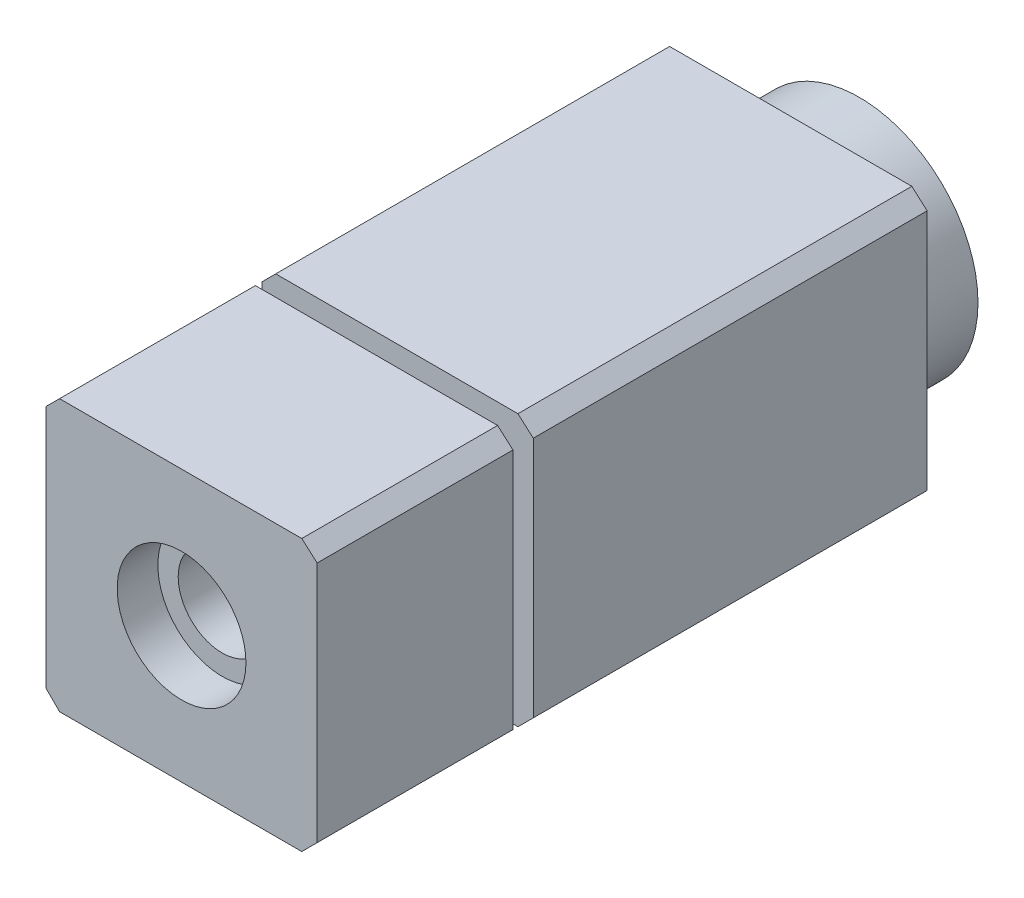
from build123d import *

# Parameters (mm, degrees)
EXTRUDE_1_DEPTH     = 80
SKETCH_3_R          = 17.5
EXTRUDE_2_DEPTH     = 10
EXTRUDE_START       = 10
SKETCH_4_R          = 17.5
EXTRUDE_3_DEPTH     = 10
SKETCH_6_R          = 9.5
CUT_EXTRUDE_3_DEPTH = 6
CUT_EXTRUDE_START   = -6
SKETCH_7_R          = 9.5
CUT_EXTRUDE_4_DEPTH = 6
SKETCH_8_R          = 6.5
CUT_EXTRUDE_5_DEPTH = 100
SKETCH_11_R         = 14.5
CUT_EXTRUDE_8_DEPTH = 3
SKETCH_13_R         = 17.5
EXTRUDE_5_DEPTH     = 10


with BuildPart() as part:
    # 草图1 → 凸台-拉伸1 (new body)
    with BuildSketch(Plane.XY):
        Polygon((-20, 18), (-18, 20), (17.735809733, 20), (20, 18), (20, -17.735809733), (17.735809733, -20), (-18, -20), (-20, -18), align=None)
    extrude(amount=EXTRUDE_1_DEPTH)

    # 草图3 → 凸台-拉伸2 (add)
    with BuildSketch(Plane.XY.offset(80)):
        Circle(SKETCH_3_R)
    extrude(amount=EXTRUDE_2_DEPTH)

    # 草图4 → 凸台-拉伸3 (add)
    with BuildSketch(Plane(origin=(0, 0, 0), x_dir=(-1, 0, 0), z_dir=(0, 0, -1)).offset(EXTRUDE_START)):
        with Locations(Location((0, 0, 0), (0, 0, 180))):
            Circle(SKETCH_4_R)
    extrude(amount=-EXTRUDE_3_DEPTH)

    # 草图6 → 切除-拉伸3 (cut)
    with BuildSketch(Plane(origin=(0, 0, -10), x_dir=(-1, 0, 0), z_dir=(0, 0, -1))):
        Circle(SKETCH_6_R)
    extrude(amount=-CUT_EXTRUDE_3_DEPTH, mode=Mode.SUBTRACT)

    # 草图7 → 切除-拉伸4 (cut)
    with BuildSketch(Plane.XY.offset(90).offset(CUT_EXTRUDE_START)):
        with Locations(Location((0, 0, 0), (0, 0, 180))):
            Circle(SKETCH_7_R)
    extrude(amount=CUT_EXTRUDE_4_DEPTH, mode=Mode.SUBTRACT)

    # 草图8 → 切除-拉伸5 (cut)
    with BuildSketch(Plane(origin=(0, 0, -10), x_dir=(-1, 0, 0), z_dir=(0, 0, -1))):
        Circle(SKETCH_8_R)
    extrude(amount=-CUT_EXTRUDE_5_DEPTH, mode=Mode.SUBTRACT)

    # 草图11 → 切除-拉伸8 (cut)
    with BuildSketch(Plane.XY.offset(61.11)):
        Polygon((17.735809733, -20), (-18, -20), (-20, -18), (-20, 18), (-18, 20), (17.735809733, 20), (20, 18), (20, -17.735809733), align=None)
        Circle(SKETCH_11_R, mode=Mode.SUBTRACT)
    extrude(amount=-CUT_EXTRUDE_8_DEPTH, mode=Mode.SUBTRACT)

    # 草图13 → 凸台-拉伸5 (add)
    with BuildSketch(Plane.XY.offset(80)):
        Polygon((-20, 18), (-20, -18), (-18, -20), (17.735809733, -20), (20, -17.735809733), (20, 18), (17.735809733, 20), (-18, 20), align=None)
        with Locations(Location((0, 0, 0), (0, 0, 180))):
            Circle(SKETCH_13_R, mode=Mode.SUBTRACT)
    extrude(amount=EXTRUDE_5_DEPTH)


solid = part.part
